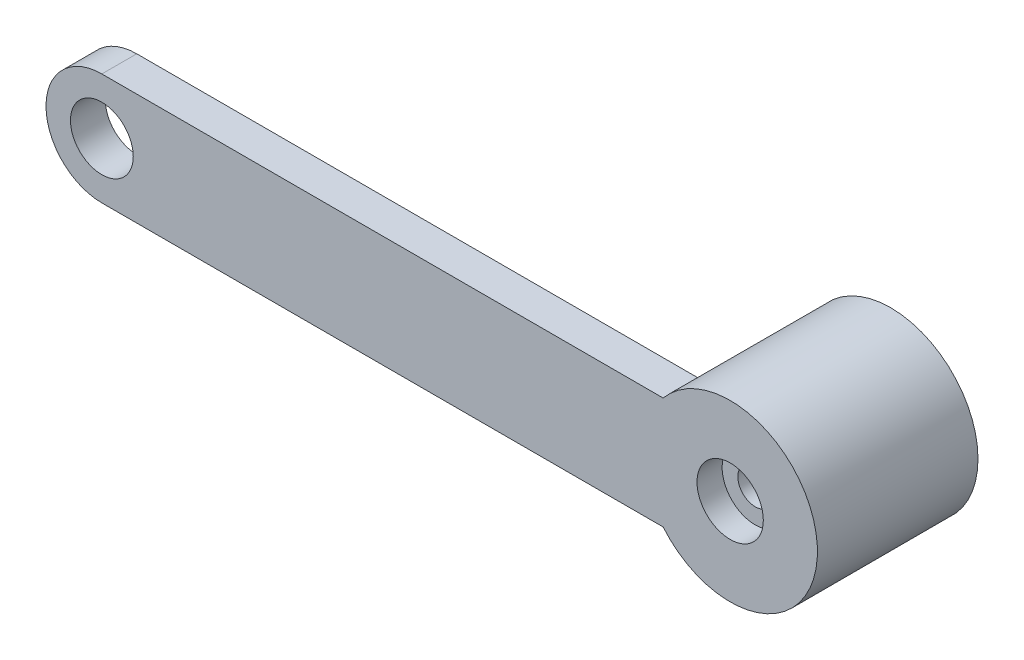
from build123d import *

# Parameters (mm, degrees)
SKETCH_1_R          = 4.5
EXTRUDE_1_DEPTH     = 5
EXTRUDE_START       = 18
SKETCH_4_R          = 12.5
EXTRUDE_3_DEPTH     = 18
SKETCH_5_R          = 9
CUT_EXTRUDE_1_DEPTH = 15
CUT_EXTRUDE_2_REACH = 72.2
SKETCH_6_R          = 2.5
SKETCH_7_R          = 4.75
CUT_EXTRUDE_3_DEPTH = 3.6


with BuildPart() as part:
    # 草图1 → 凸台-拉伸1 (new body)
    with BuildSketch(Plane.XY):
        with BuildLine():
            Line((-37.363516522, 8), (43.031797122, 8))
            ThreePointArc((43.031797122, 8), (65.136483478, 0), (43.031797122, -8))
            Line((43.031797122, -8), (-37.363516522, -8))
            ThreePointArc((-37.363516522, -8), (-45.363516522, 0), (-37.363516522, 8))
        make_face()
        with Locations((-37.363516522, 0)):
            Circle(SKETCH_1_R, mode=Mode.SUBTRACT)
    extrude(amount=EXTRUDE_1_DEPTH)

    # 草图4 → 凸台-拉伸3 (add)
    with BuildSketch(Plane(origin=(0, 0, 0), x_dir=(-1, 0, 0), z_dir=(0, 0, -1)).offset(EXTRUDE_START)):
        with Locations((-52.636483478, 0)):
            Circle(SKETCH_4_R)
    extrude(amount=-EXTRUDE_3_DEPTH)

    # 草图5 → 切除-拉伸1 (cut)
    with BuildSketch(Plane(origin=(0, 0, -18), x_dir=(-1, 0, 0), z_dir=(0, 0, -1))):
        with Locations((-52.636483478, 0)):
            Circle(SKETCH_5_R)
    extrude(amount=-CUT_EXTRUDE_1_DEPTH, mode=Mode.SUBTRACT)

    # 草图6 → 切除-拉伸2 (cut, up to next)
    with BuildSketch(Plane.XY.offset(5), mode=Mode.PRIVATE) as cut_extrude_2_sk1:
        with Locations((52.636483478, 0)):
            Circle(SKETCH_6_R)
    cut_extrude_2_tool1 = extrude(cut_extrude_2_sk1.sketch, amount=-CUT_EXTRUDE_2_REACH, mode=Mode.PRIVATE) & part.part
    add(cut_extrude_2_tool1.solids().sort_by_distance((52.636483, 0, 5))[0], mode=Mode.SUBTRACT)

    # 草图7 → 切除-拉伸3 (cut)
    with BuildSketch(Plane.XY.offset(5)):
        with Locations((52.636483478, 0)):
            Circle(SKETCH_7_R)
    extrude(amount=-CUT_EXTRUDE_3_DEPTH, mode=Mode.SUBTRACT)


solid = part.part
